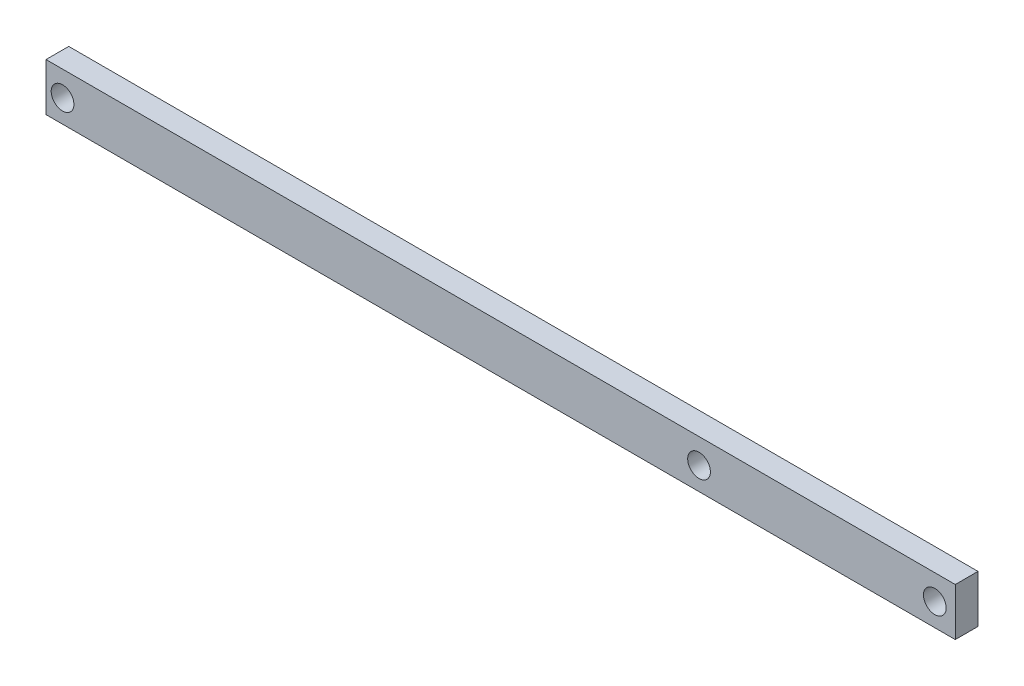
from build123d import *

# Parameters (mm, degrees)
SKETCH_1_W      = 400
SKETCH_1_H      = 20.992945259
SKETCH_1_R      = 5
EXTRUDE_1_DEPTH = 10


with BuildPart() as part:
    # 草图1 → 凸台-拉伸1 (new body)
    with BuildSketch(Plane.XY):
        with Locations((83.69982548, -1.842096306)):
            Rectangle(SKETCH_1_W, SKETCH_1_H)
        with Locations((-109.020261095, -2.318547405)):
            Circle(SKETCH_1_R, mode=Mode.SUBTRACT)
        with Locations((170.979738893, -2.321089853)):
            Circle(SKETCH_1_R, mode=Mode.SUBTRACT)
        with Locations((274.704136761, -2.321089853)):
            Circle(SKETCH_1_R, mode=Mode.SUBTRACT)
    extrude(amount=EXTRUDE_1_DEPTH)


solid = part.part
